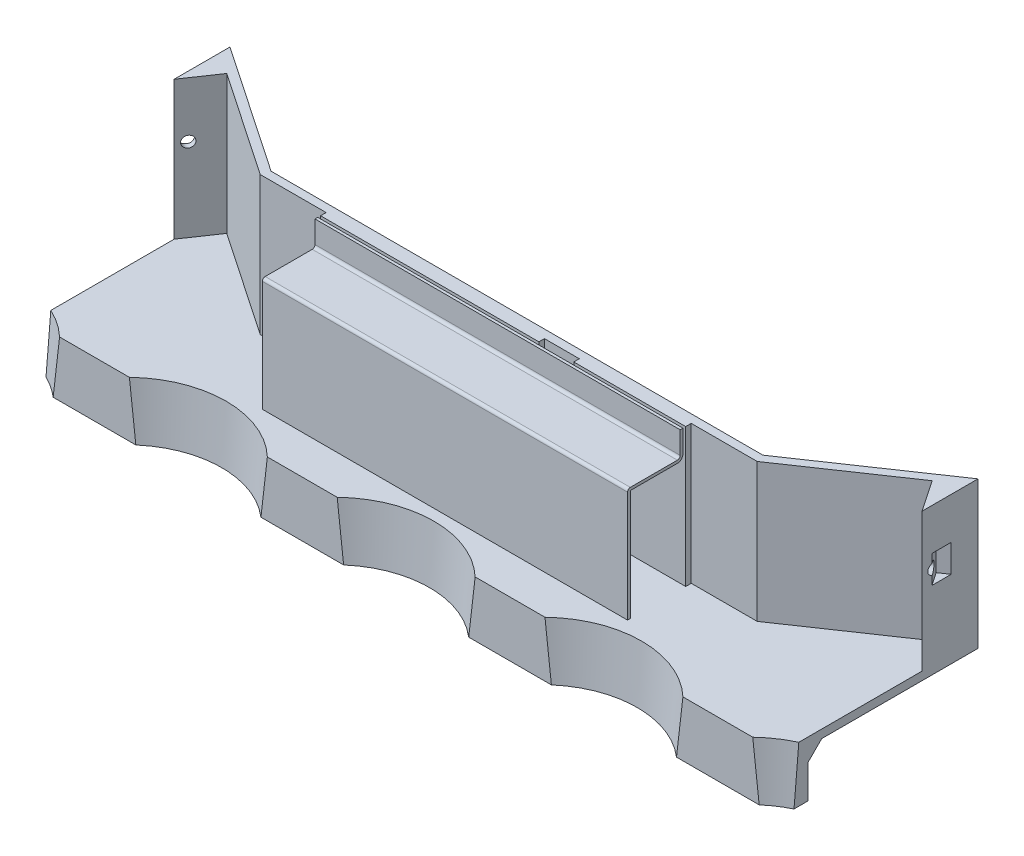
from build123d import *

# Parameters (mm, degrees)
BOSS_EXTRUDE1_DEPTH             = 135
BOSS_EXTRUDE2_REACH             = 151.416
BOSS_EXTRUDE2_DIRECTION_2_REACH = 151.416
CUT_EXTRUDE1_DEPTH              = 50
BOSS_EXTRUDE3_DEPTH             = 50
SKETCH9_R                       = 2
CUT_EXTRUDE2_DEPTH              = 262.164206304
CUT_EXTRUDE3_START              = -2
SKETCH10_W                      = 8.681737756
SKETCH10_H                      = 10
CUT_EXTRUDE3_DEPTH              = 260.164206304
SKETCH11_W                      = 78.8
SKETCH11_H                      = 50
SKETCH11_W_2                    = 40.4
BOSS_EXTRUDE4_DEPTH             = 2
BOSS_EXTRUDE5_DEPTH             = 131.8


with BuildPart() as part:
    # Sketch1 → Boss-Extrude1 (new, symmetric)
    with BuildSketch(Plane(origin=(0, 0, 0), x_dir=(0, 0, -1), z_dir=(1, 0, 0))):
        Polygon((0, 0), (0, 53), (-3, 53), (-3, 3), (-40, 3), (-40, 0), (-40, -17), (-30, -17), (-30, -5), (-25, 0), align=None)
    extrude(amount=BOSS_EXTRUDE1_DEPTH, both=True)

    # Sketch2 → Cut-Revolve1 (revolve, cut)
    with BuildSketch(Plane(origin=(0, 0, 0), x_dir=(0, 0, -1), z_dir=(1, 0, 0))):
        Polygon((-66, 3), (-30, 3), (-39, -112), (-66, -112), align=None)
    revolve(axis=Axis((0, 3, 66), (0, -1, 0)), mode=Mode.SUBTRACT)

    # Sketch3 → Cut-Revolve2 (revolve, cut)
    with BuildSketch(Plane(origin=(75, 0, 0), x_dir=(0, 0, -1), z_dir=(1, 0, 0))):
        Polygon((-30, 3), (-66, 3), (-66, -112), (-39, -112), align=None)
    cut_revolve2 = revolve(axis=Axis((75, 3, 66), (0, -1, 0)), mode=Mode.SUBTRACT)

    # Sketch4 → Cut-Revolve3 (revolve, cut)
    with BuildSketch(Plane(origin=(150, 0, 0), x_dir=(0, 0, -1), z_dir=(1, 0, 0))):
        Polygon((-30, 3), (-66, 3), (-66, -112), (-39, -112), align=None)
    cut_revolve3 = revolve(axis=Axis((150, 3, 66), (0, -1, 0)), mode=Mode.SUBTRACT)

    # Boss-Extrude2: up to this face of the body (flat: up to its plane)
    boss_extrude2_end = Plane(part.part.faces().sort_by_distance((0, 53, 1.5))[0])
    # Sketch5 → Boss-Extrude2 (add, up to the picked face)
    with BuildSketch(Plane(origin=(0, 3, 0), x_dir=(1, 0, 0), z_dir=(0, 1, 0)), mode=Mode.PRIVATE) as boss_extrude2_sk1:
        Polygon((89.696341704, -3), (135, -3), (135, 27.780279129), (135, 31.407195461), (84.358099725, -3), align=None)
    boss_extrude2_tool1 = split(extrude(boss_extrude2_sk1.sketch, amount=BOSS_EXTRUDE2_REACH, mode=Mode.PRIVATE), bisect_by=boss_extrude2_end, keep=Keep.BOTH, mode=Mode.PRIVATE)
    boss_extrude2 = boss_extrude2_tool1.solids().sort_by(Axis((118.119367, 3, -8.469065), (0, 1, 0)))[0]
    add(boss_extrude2)

    # Boss-Extrude2 direction 2: up to this face of the body (flat: up to its plane)
    boss_extrude2_direction_2_end = Plane(part.part.faces().sort_by_distance((0, 0, 12.5))[0])
    # Sketch5 → Boss-Extrude2 direction 2 (add, up to the picked face)
    with BuildSketch(Plane(origin=(0, 3, 0), x_dir=(1, 0, 0), z_dir=(0, 1, 0)), mode=Mode.PRIVATE) as boss_extrude2_direction_2_sk1:
        Polygon((89.696341704, -3), (135, -3), (135, 27.780279129), (135, 31.407195461), (84.358099725, -3), align=None)
    boss_extrude2_direction_2_tool1 = split(extrude(boss_extrude2_direction_2_sk1.sketch, amount=-BOSS_EXTRUDE2_DIRECTION_2_REACH, mode=Mode.PRIVATE), bisect_by=boss_extrude2_direction_2_end, keep=Keep.BOTH, mode=Mode.PRIVATE)
    boss_extrude2_direction_2 = boss_extrude2_direction_2_tool1.solids().sort_by(Axis((118.119367, 3, -8.469065), (0, -1, 0)))[0]
    add(boss_extrude2_direction_2)

    # Sketch7 → Cut-Extrude1 (cut)
    with BuildSketch(Plane(origin=(0, 3, 0), x_dir=(1, 0, 0), z_dir=(0, 1, 0))):
        Polygon((89.696341704, -3), (135, 27.780279129), (135, -3), align=None)
    cut_extrude1 = extrude(amount=CUT_EXTRUDE1_DEPTH, mode=Mode.SUBTRACT)

    # Sketch8 → Boss-Extrude3 (add)
    with BuildSketch(Plane(origin=(0, 3, 0), x_dir=(1, 0, 0), z_dir=(0, 1, 0))):
        Polygon((135, 27.780279129), (127.311099154, 22.556274642), (135, 11.239439757), align=None)
    boss_extrude3 = extrude(amount=BOSS_EXTRUDE3_DEPTH)

    # Sketch9 → Cut-Extrude2 (cut, through all)
    with BuildSketch(Plane(origin=(97.588254801, 0, -66.303557715), x_dir=(0.5619827673392628, 0, 0.8271489401635621), z_dir=(-0.8271489401635621, 0, 0.5619827673392628))):
        with Locations((62.889245152, 33)):
            Circle(SKETCH9_R)
    cut_extrude2 = extrude(amount=-CUT_EXTRUDE2_DEPTH, mode=Mode.SUBTRACT)

    # Sketch10 → Cut-Extrude3 (cut, through all)
    with BuildSketch(Plane(origin=(97.588254801, 0, -66.303557715), x_dir=(0.5619827673392628, 0, 0.8271489401635621), z_dir=(-0.8271489401635621, 0, 0.5619827673392628)).offset(CUT_EXTRUDE3_START)):
        with Locations((62.23011403, 33)):
            Rectangle(SKETCH10_W, SKETCH10_H)
    cut_extrude3 = extrude(amount=-CUT_EXTRUDE3_DEPTH, mode=Mode.SUBTRACT)

    # Mirror1: Cut-Revolve2, Cut-Revolve3, Boss-Extrude2, Boss-Extrude2 direction 2, Cut-Extrude1, Boss-Extrude3, Cut-Extrude2, Cut-Extrude3 across plane
    add(cut_revolve2.mirror(Plane(origin=(0, 0, 0), x_dir=(0, 0, 1), z_dir=(1, 0, 0))), mode=Mode.SUBTRACT)
    add(cut_revolve3.mirror(Plane(origin=(0, 0, 0), x_dir=(0, 0, 1), z_dir=(1, 0, 0))), mode=Mode.SUBTRACT)
    add(boss_extrude2.mirror(Plane(origin=(0, 0, 0), x_dir=(0, 0, 1), z_dir=(1, 0, 0))))
    add(boss_extrude2_direction_2.mirror(Plane(origin=(0, 0, 0), x_dir=(0, 0, 1), z_dir=(1, 0, 0))))
    add(cut_extrude1.mirror(Plane(origin=(0, 0, 0), x_dir=(0, 0, 1), z_dir=(1, 0, 0))), mode=Mode.SUBTRACT)
    add(boss_extrude3.mirror(Plane(origin=(0, 0, 0), x_dir=(0, 0, 1), z_dir=(1, 0, 0))))
    add(cut_extrude2.mirror(Plane(origin=(0, 0, 0), x_dir=(0, 0, 1), z_dir=(1, 0, 0))), mode=Mode.SUBTRACT)
    add(cut_extrude3.mirror(Plane(origin=(0, 0, 0), x_dir=(0, 0, 1), z_dir=(1, 0, 0))), mode=Mode.SUBTRACT)

    # Sketch11 → Boss-Extrude4 (add)
    with BuildSketch(Plane.XY.offset(3)):
        with Locations((-26.5, 28)):
            Rectangle(SKETCH11_W, SKETCH11_H)
        with Locations((45.7, 28)):
            Rectangle(SKETCH11_W_2, SKETCH11_H)
    extrude(amount=BOSS_EXTRUDE4_DEPTH)

    # Sketch12 → Boss-Extrude5 (add)
    with BuildSketch(Plane.ZY.offset(65.9)):
        with BuildLine():
            Line((6, 53), (6, 45))
            ThreePointArc((6, 45), (6.585786438, 43.585786438), (8, 43))
            Line((8, 43), (25, 43))
            Line((25, 43), (25, 3))
            Line((25, 3), (26, 3))
            Line((26, 3), (26, 43))
            ThreePointArc((26, 43), (25.707106781, 43.707106781), (25, 44))
            Line((25, 44), (8, 44))
            ThreePointArc((8, 44), (7.292893219, 44.292893219), (7, 45))
            Line((7, 45), (7, 53))
            Line((7, 53), (6, 53))
        make_face()
    extrude(amount=-BOSS_EXTRUDE5_DEPTH)


solid = part.part
